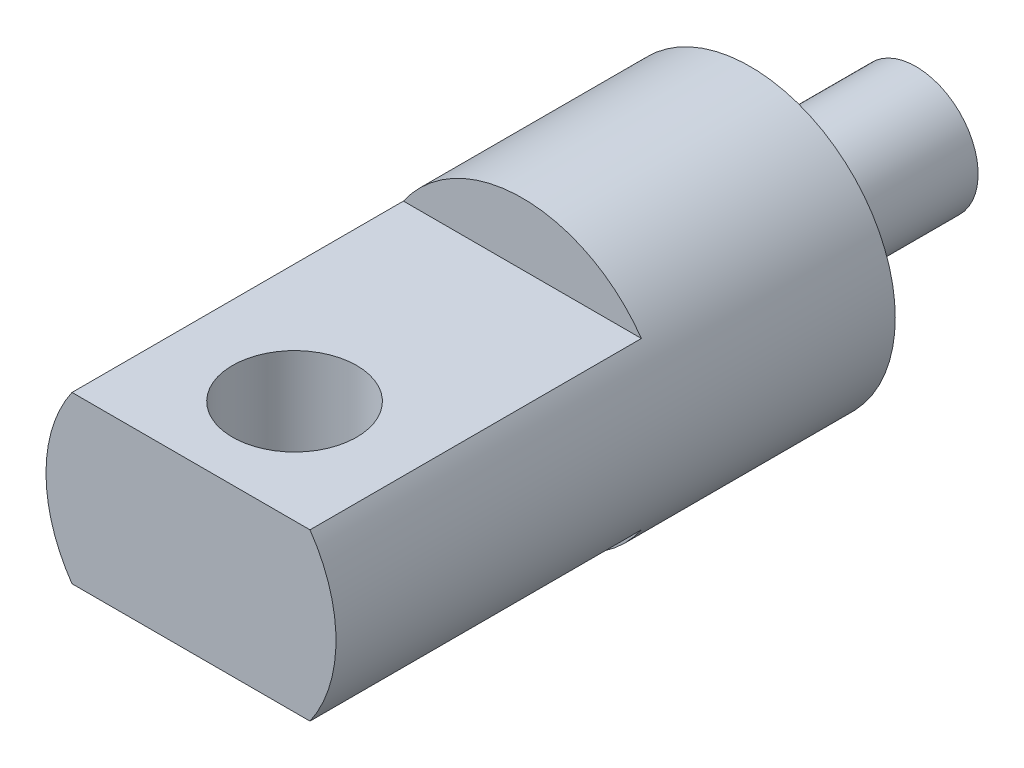
from build123d import *

# Parameters (mm, degrees)
BOSS_EXTRUDE2_DEPTH      = 25
BOSS_EXTRUDE2_DEPTH_BACK = 150
SKETCH3_R                = 35
SKETCH4_R                = 35
SKETCH4_R_2              = 15
CUT_EXTRUDE1_DEPTH       = 40
CUT_EXTRUDE2_START       = -80
CUT_EXTRUDE2_DEPTH       = 80
SKETCH7_R                = 15
CUT_EXTRUDE3_DEPTH       = 164.554272338


with BuildPart() as part:
    # Sketch3 → Boss-Extrude2 (new, two sides: drawn at the far end of the back side and taken through both)
    with BuildSketch(Plane.XY.offset(-BOSS_EXTRUDE2_DEPTH_BACK)):
        Circle(SKETCH3_R)
    extrude(amount=BOSS_EXTRUDE2_DEPTH + BOSS_EXTRUDE2_DEPTH_BACK)

    # Sketch4 → Cut-Extrude1 (cut)
    with BuildSketch(Plane(origin=(0, 0, -150), x_dir=(-1, 0, 0), z_dir=(0, 0, -1))):
        Circle(SKETCH4_R)
        Circle(SKETCH4_R_2, mode=Mode.SUBTRACT)
    extrude(amount=-CUT_EXTRUDE1_DEPTH, mode=Mode.SUBTRACT)

    # Sketch5 → Cut-Extrude2 (cut)
    with BuildSketch(Plane.XY.offset(25).offset(CUT_EXTRUDE2_START)):
        with BuildLine():
            Line((-28.722813233, 20), (28.722813233, 20))
            ThreePointArc((28.722813233, 20), (0, 35), (-28.722813233, 20))
        make_face()
        with BuildLine():
            Line((-28.722813233, -20), (28.722813233, -20))
            ThreePointArc((28.722813233, -20), (0, -35), (-28.722813233, -20))
        make_face()
    extrude(amount=CUT_EXTRUDE2_DEPTH, mode=Mode.SUBTRACT)

    # Sketch7 → Cut-Extrude3 (cut, through all)
    with BuildSketch(Plane.XZ.offset(20)):
        with Locations(Location((0, 0, 0), (0, 0, 270))):
            Circle(SKETCH7_R)
    extrude(amount=-CUT_EXTRUDE3_DEPTH, mode=Mode.SUBTRACT)


solid = part.part
